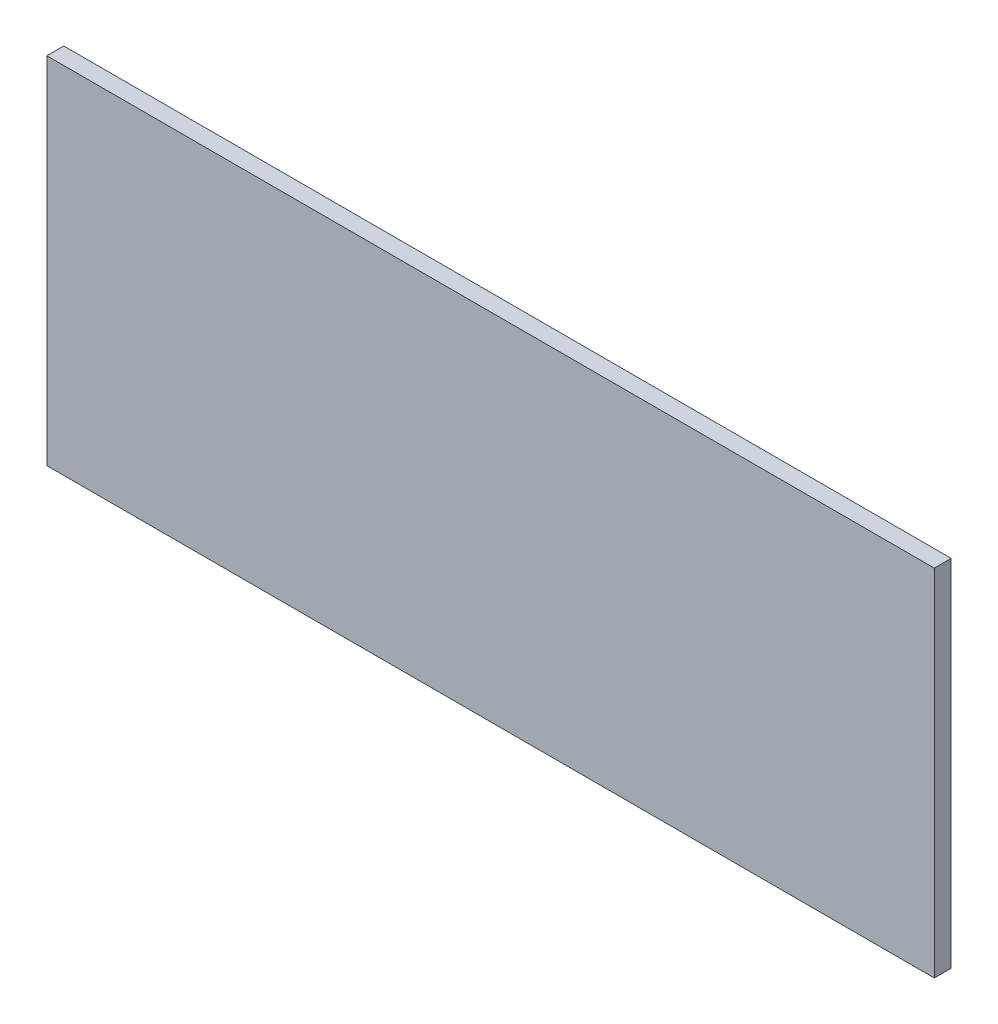
from build123d import *

# Parameters (mm, degrees)
CROQUIS3_W              = 210
CROQUIS3_H              = 84
SALIENTE_EXTRUIR2_DEPTH = 4


with BuildPart() as part:
    # Croquis3 → Saliente-Extruir2 (new body)
    with BuildSketch(Plane.XY):
        with Locations((14.498385096, 42)):
            Rectangle(CROQUIS3_W, CROQUIS3_H)
    extrude(amount=-SALIENTE_EXTRUIR2_DEPTH)


solid = part.part
